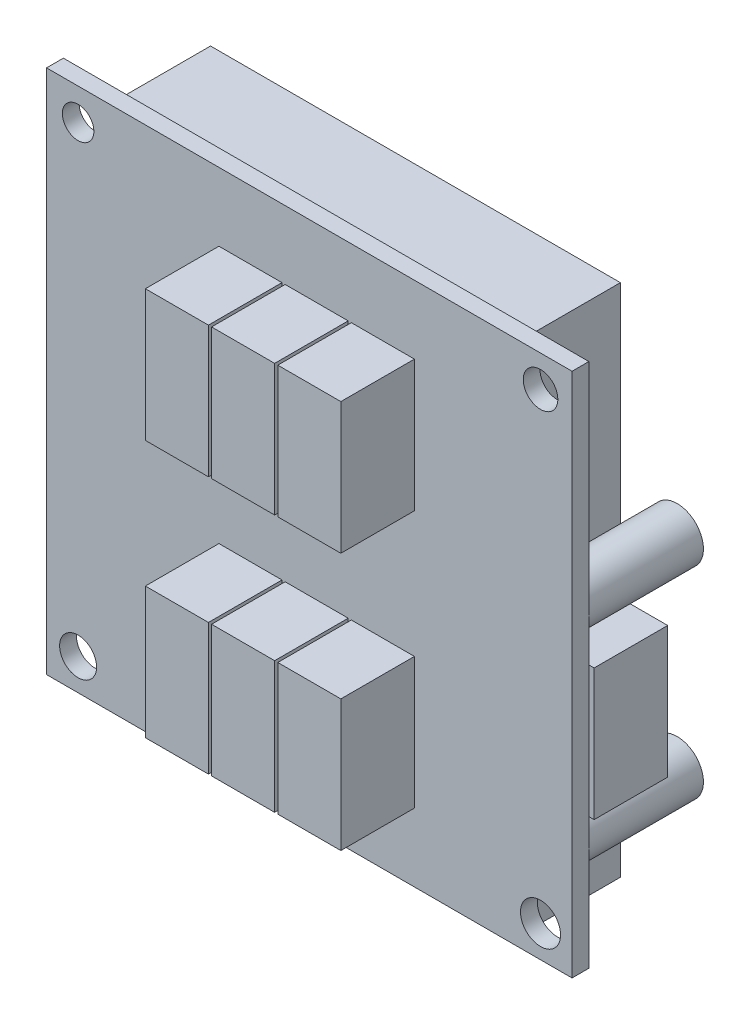
from build123d import *

# Parameters (mm, degrees)
SKETCH1_W      = 50
SKETCH1_H      = 50
SKETCH1_R      = 1.5
SKETCH1_R_2    = 1.646935024
SKETCH1_R_3    = 1.908192471
SKETCH1_R_4    = 1.759080553
EXTRUDE2_DEPTH = 0.8
SKETCH2_W      = 6
SKETCH2_H      = 12.5
EXTRUDE3_DEPTH = 7
SKETCH3_W      = 6
SKETCH3_H      = 12.5
EXTRUDE4_DEPTH = 7
SKETCH4_W      = 39
SKETCH4_H      = 23
EXTRUDE5_DEPTH = 8.5
SKETCH5_R      = 2.5
EXTRUDE8_DEPTH = 11


with BuildPart() as part:
    # Sketch1 → Extrude2 (new, symmetric)
    with BuildSketch(Plane.XY):
        Rectangle(SKETCH1_W, SKETCH1_H)
        with Locations((-22, 22)):
            Circle(SKETCH1_R, mode=Mode.SUBTRACT)
        with Locations((22, 22)):
            Circle(SKETCH1_R_2, mode=Mode.SUBTRACT)
        with Locations((22, -22)):
            Circle(SKETCH1_R_3, mode=Mode.SUBTRACT)
        with Locations((-22, -22)):
            Circle(SKETCH1_R_4, mode=Mode.SUBTRACT)
    extrude(amount=EXTRUDE2_DEPTH, both=True)

    # Sketch2 → Extrude3 (add)
    with BuildSketch(Plane.XY.offset(0.8)):
        with Locations((7, 12.25)):
            Rectangle(SKETCH2_W, SKETCH2_H)
        with Locations((7, -12.25)):
            Rectangle(SKETCH2_W, SKETCH2_H)
        with Locations((0.7, 12.25)):
            Rectangle(SKETCH2_W, SKETCH2_H)
        with Locations((0.7, -12.25)):
            Rectangle(SKETCH2_W, SKETCH2_H)
        with Locations((-5.6, 12.25)):
            Rectangle(SKETCH2_W, SKETCH2_H)
        with Locations((-5.6, -12.25)):
            Rectangle(SKETCH2_W, SKETCH2_H)
    extrude(amount=EXTRUDE3_DEPTH)

    # Sketch3 → Extrude4 (add)
    with BuildSketch(Plane(origin=(0, 0, -0.8), x_dir=(-1, 0, 0), z_dir=(0, 0, -1))):
        with Locations((-22.5, -6.25)):
            Rectangle(SKETCH3_W, SKETCH3_H)
    extrude(amount=EXTRUDE4_DEPTH)

    # Sketch4 → Extrude5 (add)
    with BuildSketch(Plane(origin=(0, 0, -0.8), x_dir=(-1, 0, 0), z_dir=(0, 0, -1))):
        with Locations((0, -13)):
            Rectangle(SKETCH4_W, SKETCH4_H)
        with Locations((0, 13)):
            Rectangle(SKETCH4_W, SKETCH4_H)
    extrude(amount=EXTRUDE5_DEPTH)

    # Sketch5 → Extrude8 (add)
    with BuildSketch(Plane(origin=(0, 0, -0.8), x_dir=(-1, 0, 0), z_dir=(0, 0, -1))):
        with Locations(Location((22.4, -3, 0), (0, 0, 180))):
            Circle(SKETCH5_R)
        with Locations(Location((22.4, 3, 0), (0, 0, 180))):
            Circle(SKETCH5_R)
        with Locations(Location((-22.4, -15.2, 0), (0, 0, 180))):
            Circle(SKETCH5_R)
        with Locations(Location((-22.4, 4, 0), (0, 0, 180))):
            Circle(SKETCH5_R)
    extrude(amount=EXTRUDE8_DEPTH)


solid = part.part
